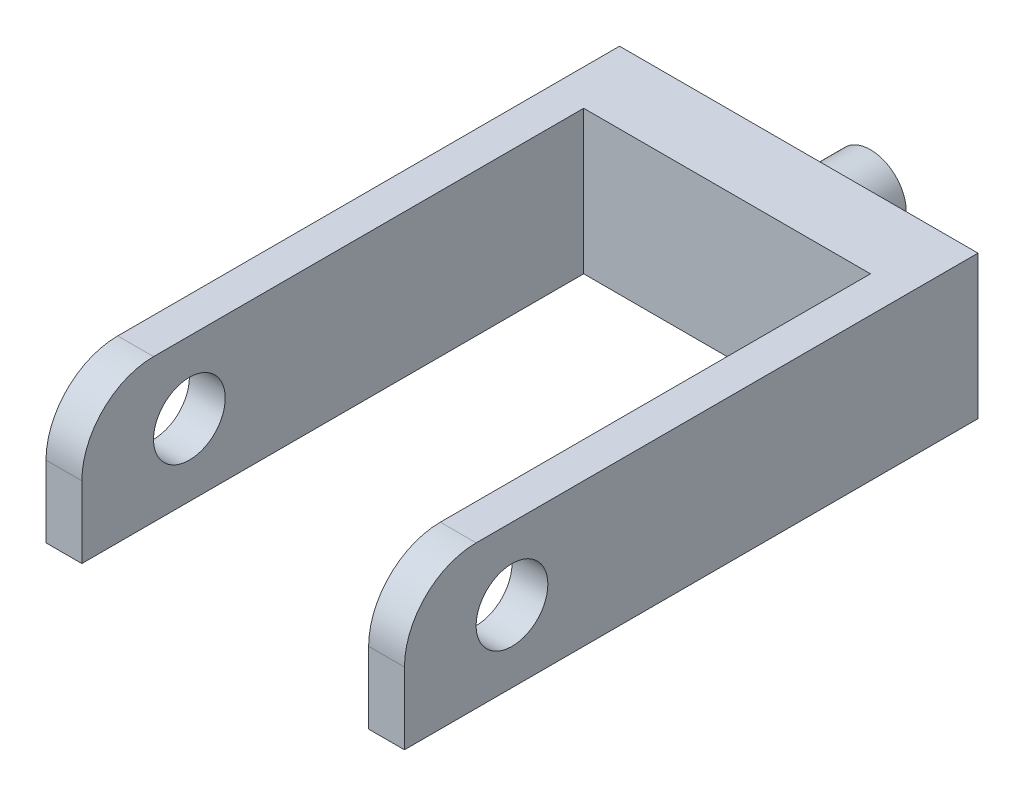
from build123d import *

# Parameters (mm, degrees)
SKETCH1_W           = 127
SKETCH1_H           = 203.2
BOSS_EXTRUDE1_DEPTH = 50.8
CUT_EXTRUDE1_DEPTH  = 254
SKETCH4_R           = 12.7
CUT_EXTRUDE2_DEPTH  = 254
SKETCH5_R           = 12.7
BOSS_EXTRUDE2_DEPTH = 25.4
FILLET1_R           = 25.4
FILLET2_R           = 25.4


with BuildPart() as part:
    # Sketch1 → Boss-Extrude1 (new body)
    with BuildSketch(Plane(origin=(0, 0, 0), x_dir=(1, 0, 0), z_dir=(0, 1, 0))):
        with Locations((-63.5, -101.6)):
            Rectangle(SKETCH1_W, SKETCH1_H)
    extrude(amount=BOSS_EXTRUDE1_DEPTH)

    # Sketch3 → Cut-Extrude1 (cut)
    with BuildSketch(Plane(origin=(0, 50.8, 0), x_dir=(1, 0, 0), z_dir=(0, 1, 0))):
        Polygon((-63.5, -25.4), (-12.7, -25.4), (-12.7, -203.2), (-114.3, -203.2), (-114.3, -25.4), align=None)
    extrude(amount=-CUT_EXTRUDE1_DEPTH, mode=Mode.SUBTRACT)

    # Sketch4 → Cut-Extrude2 (cut)
    with BuildSketch(Plane(origin=(0, 0, 0), x_dir=(0, 0, -1), z_dir=(1, 0, 0))):
        with Locations((-165.1, 25.4)):
            Circle(SKETCH4_R)
    extrude(amount=-CUT_EXTRUDE2_DEPTH, mode=Mode.SUBTRACT)

    # Sketch5 → Boss-Extrude2 (add)
    with BuildSketch(Plane(origin=(0, 0, 0), x_dir=(-1, 0, 0), z_dir=(0, 0, -1))):
        with Locations((63.5, 25.4)):
            Circle(SKETCH5_R)
    extrude(amount=BOSS_EXTRUDE2_DEPTH)

    # Fillet1
    fillet1_edges = [part.edges().sort_by_distance(p)[0] for p in [
        (-120.65, 50.8, 203.2),
    ]]
    fillet(fillet1_edges, radius=FILLET1_R)

    # Fillet2
    fillet2_edges = [part.edges().sort_by_distance(p)[0] for p in [
        (-6.35, 50.8, 203.2),
    ]]
    fillet(fillet2_edges, radius=FILLET2_R)


solid = part.part
